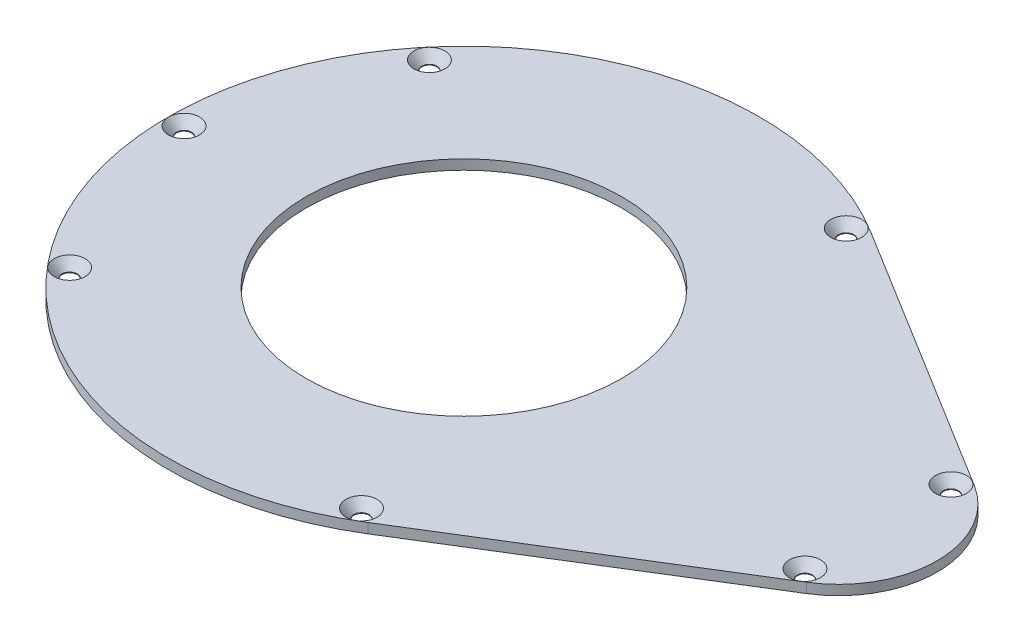
from build123d import *
from build123d.topology import SkipClean

# Parameters (mm, degrees)
SKETCH1_R                                         = 47.625
BOSS_EXTRUDE1_DEPTH                               = 24.13
SKETCH2_R                                         = 46.0375
CUT_EXTRUDE1_DEPTH                                = 20.955
SKETCH3_R                                         = 30.48
CUT_EXTRUDE2_DEPTH                                = 71.536467696
BOSS_EXTRUDE2_START                               = -24.13
BOSS_EXTRUDE2_DEPTH                               = 24.13
CUT_EXTRUDE3_DEPTH                                = 20.955
BOSS_EXTRUDE3_START                               = 3.81
BOSS_EXTRUDE3_DEPTH                               = 3.81
SKETCH7_R                                         = 11.176
CUT_EXTRUDE4_DEPTH                                = 3.81
CHAMFER1_SIZE                                     = 0.762
SKETCH8_R                                         = 5.08
CUT_EXTRUDE5_DEPTH                                = 93.163254725
CSK_FOR_M2_5_FLAT_HEAD_MACHINE_SCREW1_D           = 2.9
CSK_FOR_M2_5_FLAT_HEAD_MACHINE_SCREW1_CSINK_D     = 5.5
CSK_FOR_M2_5_FLAT_HEAD_MACHINE_SCREW1_CSINK_ANGLE = 90
CIRPATTERN1_COUNT                                 = 3
BOSS_EXTRUDE4_DEPTH                               = 5.588
SKETCH12_R                                        = 32.0675
SKETCH12_R_2                                      = 30.48
BOSS_EXTRUDE5_DEPTH                               = 5.588
FILLET2_R                                         = 3.175
F_10_32_TAPPED_HOLE1_D                            = 4.0386
CIRPATTERN2_COUNT                                 = 6
BOSS_EXTRUDE6_REACH                               = 96.68
SKETCH19_R                                        = 2.54
FILLET3_R                                         = 3.175
F_4_40_TAPPED_HOLE1_D                             = 2.2606
F_4_40_TAPPED_HOLE1_DEPTH                         = 7.62
F_4_40_TAPPED_HOLE1_TIP                           = 0.679152758
BOSS_EXTRUDE8_START                               = 1.5875
BOSS_EXTRUDE8_DEPTH                               = 1.5875
CUT_EXTRUDE6_START                                = -29.718
CUT_EXTRUDE6_DEPTH                                = 29.718
CSK_FOR_2_FLAT_HEAD_SOCKET_CAP_SCREW1_A_COUNT     = 2
CSK_FOR_2_FLAT_HEAD_SOCKET_CAP_SCREW1_A_PITCH     = 57.960158765
CSK_FOR_2_FLAT_HEAD_SOCKET_CAP_SCRE_2_COUNT       = 2
CSK_FOR_2_FLAT_HEAD_SOCKET_CAP_SCRE_2_PITCH       = 78.089510659
CSK_FOR_2_FLAT_HEAD_SOCKET_CAP_SCRE_3_COUNT       = 2
CSK_FOR_2_FLAT_HEAD_SOCKET_CAP_SCRE_3_PITCH       = 88.800115089
CSK_FOR_2_FLAT_HEAD_SOCKET_CAP_SCRE_4_COUNT       = 2
CSK_FOR_2_FLAT_HEAD_SOCKET_CAP_SCRE_4_PITCH       = 78.089510659
CSK_FOR_2_FLAT_HEAD_SOCKET_CAP_SCRE_5_COUNT       = 2
CSK_FOR_2_FLAT_HEAD_SOCKET_CAP_SCRE_5_PITCH       = 67.315682226
CSK_FOR_2_FLAT_HEAD_SOCKET_CAP_SCRE_6_COUNT       = 2
CSK_FOR_2_FLAT_HEAD_SOCKET_CAP_SCRE_6_PITCH       = 51.908600383
SKETCH26_R                                        = 25.4
CUT_EXTRUDE7_DEPTH                                = 1.5875


with BuildPart() as part:
    # Sketch1 → Boss-Extrude1 (new body)
    with BuildSketch(Plane(origin=(0, 0, 0), x_dir=(1, 0, 0), z_dir=(0, 1, 0))):
        with Locations(Location((0, 0, 0), (0, 0, 90))):
            Circle(SKETCH1_R)
    extrude(amount=BOSS_EXTRUDE1_DEPTH)

    # Sketch2 → Cut-Extrude1 (cut)
    with BuildSketch(Plane.XZ):
        with Locations(Location((0, 0, 0), (0, 0, 270))):
            Circle(SKETCH2_R)
    extrude(amount=-CUT_EXTRUDE1_DEPTH, mode=Mode.SUBTRACT)

    # Sketch3 → Cut-Extrude2 (cut, through all)
    with BuildSketch(Plane.XZ.offset(-20.955)):
        with Locations(Location((0, 0, 0), (0, 0, 270))):
            Circle(SKETCH3_R)
    extrude(amount=-CUT_EXTRUDE2_DEPTH, mode=Mode.SUBTRACT)

    # Sketch4 → Boss-Extrude2 (add)
    with BuildSketch(Plane(origin=(0, 24.13, 0), x_dir=(1, 0, 0), z_dir=(0, 1, 0)).offset(BOSS_EXTRUDE2_START)):
        with BuildLine():
            Line((25.047860479, 40.506114482), (68.717466826, 13.502038161))
            ThreePointArc((68.717466826, 13.502038161), (76.24318, 0), (68.717466826, -13.502038161))
            Line((68.717466826, -13.502038161), (25.047860479, -40.506114482))
            ThreePointArc((25.047860479, -40.506114482), (47.625, 0), (25.047860479, 40.506114482))
        make_face()
    extrude(amount=BOSS_EXTRUDE2_DEPTH)

    # Sketch5 → Cut-Extrude3 (cut)
    with BuildSketch(Plane.XZ):
        with BuildLine():
            Line((24.212931796, -39.155910666), (67.882538144, -12.151834345))
            ThreePointArc((67.882538144, -12.151834345), (74.65568, 0), (67.882538144, 12.151834345))
            Line((67.882538144, 12.151834345), (24.212931796, 39.155910666))
            ThreePointArc((24.212931796, 39.155910666), (46.0375, 0), (24.212931796, -39.155910666))
        make_face()
    extrude(amount=-CUT_EXTRUDE3_DEPTH, mode=Mode.SUBTRACT)

    # Sketch6 → Boss-Extrude3 (add)
    with BuildSketch(Plane.XZ.offset(-20.955).offset(BOSS_EXTRUDE3_START)):
        with BuildLine():
            Line((53.153553418, 21.25983098), (46.04773497, 25.653872505))
            Line((46.04773497, 25.653872505), (46.882663653, 27.004076321))
            Line((46.882663653, 27.004076321), (68.717466826, 13.502038161))
            ThreePointArc((68.717466826, 13.502038161), (76.24318, 0), (68.717466826, -13.502038161))
            Line((68.717466826, -13.502038161), (46.882663653, -27.004076321))
            Line((46.882663653, -27.004076321), (46.04773497, -25.653872505))
            Line((46.04773497, -25.653872505), (53.153553418, -21.25983098))
            ThreePointArc((53.153553418, -21.25983098), (56.162954155, -15.965000538), (53.331952458, -10.572677144))
            ThreePointArc((53.331952458, -10.572677144), (47.66818, 0), (53.331952458, 10.572677144))
            ThreePointArc((53.331952458, 10.572677144), (56.162954155, 15.965000538), (53.153553418, 21.25983098))
        make_face()
    extrude(amount=-BOSS_EXTRUDE3_DEPTH)

    # Sketch7 → Cut-Extrude4 (cut)
    with BuildSketch(Plane(origin=(0, 24.13, 0), x_dir=(1, 0, 0), z_dir=(0, 1, 0))):
        with Locations(Location((60.36818, 0, 0), (0, 0, 270))):
            Circle(SKETCH7_R)
    extrude(amount=-CUT_EXTRUDE4_DEPTH, mode=Mode.SUBTRACT)

    # Chamfer1
    chamfer1_edges = [part.edges().sort_by_distance(p)[0] for p in [
        (60.36818, 24.13, -11.176),
    ]]
    chamfer(chamfer1_edges, length=CHAMFER1_SIZE)

    # Sketch8 → Cut-Extrude5 (cut, through all)
    with BuildSketch(Plane(origin=(0, 20.32, 0), x_dir=(1, 0, 0), z_dir=(0, 1, 0))):
        with Locations(Location((60.36818, 0, 0), (0, 0, 270))):
            Circle(SKETCH8_R)
    extrude(amount=-CUT_EXTRUDE5_DEPTH, mode=Mode.SUBTRACT)

    # CSK for M2.5 Flat Head Machine Screw1 (through all)
    with Locations(Plane.XZ.offset(-17.145)):
        with Locations((67.36818, 0)):
            csk_for_m2_5_flat_head_machine_screw1 = CounterSinkHole(CSK_FOR_M2_5_FLAT_HEAD_MACHINE_SCREW1_D / 2, CSK_FOR_M2_5_FLAT_HEAD_MACHINE_SCREW1_CSINK_D / 2, counter_sink_angle=CSK_FOR_M2_5_FLAT_HEAD_MACHINE_SCREW1_CSINK_ANGLE)

    # CirPattern1: CSK for M2.5 Flat Head Machine Screw1 ×3 about axis
    cirpattern1_axis = Axis((60.36818, 0, 0), (0, 1, 0))
    for i in range(1, CIRPATTERN1_COUNT):
        add(csk_for_m2_5_flat_head_machine_screw1.rotate(cirpattern1_axis, i * 360 / CIRPATTERN1_COUNT), mode=Mode.SUBTRACT)

    # Sketch11 → Boss-Extrude4 (add)
    with BuildSketch(Plane(origin=(0, 24.13, 0), x_dir=(1, 0, 0), z_dir=(0, 1, 0))):
        with BuildLine():
            Line((-30.83887705, 27.39889836), (-23.975769003, 18.820013302))
            ThreePointArc((-23.975769003, 18.820013302), (-19.040705049, 23.800881312), (-13.098014904, 27.522216582))
            Line((-13.098014904, 27.522216582), (-19.96112295, 36.10110164))
            ThreePointArc((-19.96112295, 36.10110164), (-29.75110164, 37.18887705), (-30.83887705, 27.39889836))
        make_face()
        with BuildLine():
            Line((19.729280139, 36.286575888), (12.821655, 27.652044464))
            ThreePointArc((12.821655, 27.652044464), (19.040705049, 23.800881312), (24.163094721, 18.578892687))
            Line((24.163094721, 18.578892687), (31.070719861, 27.213424112))
            ThreePointArc((31.070719861, 27.213424112), (29.936575888, 37.420719861), (19.729280139, 36.286575888))
        make_face()
    boss_extrude4 = extrude(amount=BOSS_EXTRUDE4_DEPTH)

    # Mirror1: Boss-Extrude4 across plane
    with SkipClean():  # the faces are left unmerged after this step: merging them gives an invalid solid
        add(boss_extrude4.mirror(Plane.XY))

    # Sketch12 → Boss-Extrude5 (add)
    with BuildSketch(Plane(origin=(0, 24.13, 0), x_dir=(1, 0, 0), z_dir=(0, 1, 0))):
        Circle(SKETCH12_R)
        with Locations(Location((0, 0, 0), (0, 0, 90))):
            Circle(SKETCH12_R_2, mode=Mode.SUBTRACT)
    extrude(amount=BOSS_EXTRUDE5_DEPTH)

    # Fillet2
    fillet2_edges = [part.edges().sort_by_distance(p)[0] for p in [
        (-24.993040349, 26.924, 20.091602484),
        (-14.115286249, 26.924, 28.793805764),
        (13.841247416, 26.924, 28.926534985),
        (25.182687137, 26.924, 19.853383208),
        (25.182687137, 26.924, -19.853383208),
        (13.841247416, 26.924, -28.926534985),
        (-14.115286249, 26.924, -28.793805764),
        (-24.993040349, 26.924, -20.091602484),
    ]]
    fillet(fillet2_edges, radius=FILLET2_R)

    # #10-32 Tapped Hole1 (through all)
    with Locations(Plane(origin=(0, 29.718, 0), x_dir=(-1, 0, 0), z_dir=(0, 1, 0))):
        with Locations((25.4, -31.75), (-25.4, -31.75), (25.4, 31.75), (-25.4, 31.75)):
            Hole(F_10_32_TAPPED_HOLE1_D / 2)

    # Sketch17 → #4 Clearance Hole1 (revolve, cut)
    with BuildSketch(Plane(origin=(0, 24.13, -35.56), x_dir=(0, 0, 1), z_dir=(1, 0, 0))):
        Polygon((0, 0), (0, 84.038574487), (1.63195, 83.058), (1.63195, 0), align=None)
    f_4_clearance_hole1 = revolve(axis=Axis((0, 30.48, -35.56), (0, -1, 0)), mode=Mode.SUBTRACT)

    # CirPattern2: #4 Clearance Hole1 ×6 about axis
    cirpattern2_axis = Axis((0, 0, 0), (0, 1, 0))
    for i in range(1, CIRPATTERN2_COUNT):
        add(f_4_clearance_hole1.rotate(cirpattern2_axis, i * 360 / CIRPATTERN2_COUNT), mode=Mode.SUBTRACT)

    # Boss-Extrude6: up to this face of the body (flat: up to its plane)
    boss_extrude6_end = Plane(part.part.faces().sort_by_distance((-44.661893979, 20.955, 0))[0])
    # Sketch19 → Boss-Extrude6 (add, up to the picked face)
    with BuildSketch(Plane.XZ, mode=Mode.PRIVATE) as boss_extrude6_sk1:
        with Locations((-45.085, 0)):
            Circle(SKETCH19_R)
    boss_extrude6_tool1 = split(extrude(boss_extrude6_sk1.sketch, amount=-BOSS_EXTRUDE6_REACH, mode=Mode.PRIVATE), bisect_by=boss_extrude6_end, keep=Keep.BOTH, mode=Mode.PRIVATE)
    # Sketch19 → Boss-Extrude6 (add, up to the picked face)
    with BuildSketch(Plane.XZ, mode=Mode.PRIVATE) as boss_extrude6_sk2:
        with Locations((-34.537113718, 28.980079383)):
            Circle(SKETCH19_R)
    boss_extrude6_tool2 = split(extrude(boss_extrude6_sk2.sketch, amount=-BOSS_EXTRUDE6_REACH, mode=Mode.PRIVATE), bisect_by=boss_extrude6_end, keep=Keep.BOTH, mode=Mode.PRIVATE)
    # Sketch19 → Boss-Extrude6 (add, up to the picked face)
    with BuildSketch(Plane.XZ, mode=Mode.PRIVATE) as boss_extrude6_sk3:
        with Locations((66.702734661, 11.761491808)):
            Circle(SKETCH19_R)
    boss_extrude6_tool3 = split(extrude(boss_extrude6_sk3.sketch, amount=-BOSS_EXTRUDE6_REACH, mode=Mode.PRIVATE), bisect_by=boss_extrude6_end, keep=Keep.BOTH, mode=Mode.PRIVATE)
    # Sketch19 → Boss-Extrude6 (add, up to the picked face)
    with BuildSketch(Plane.XZ, mode=Mode.PRIVATE) as boss_extrude6_sk4:
        with Locations((22.5425, 39.04475533)):
            Circle(SKETCH19_R)
    boss_extrude6_tool4 = split(extrude(boss_extrude6_sk4.sketch, amount=-BOSS_EXTRUDE6_REACH, mode=Mode.PRIVATE), bisect_by=boss_extrude6_end, keep=Keep.BOTH, mode=Mode.PRIVATE)
    # Sketch19 → Boss-Extrude6 (add, up to the picked face)
    with BuildSketch(Plane.XZ, mode=Mode.PRIVATE) as boss_extrude6_sk5:
        with Locations((66.702734661, -11.761491808)):
            Circle(SKETCH19_R)
    boss_extrude6_tool5 = split(extrude(boss_extrude6_sk5.sketch, amount=-BOSS_EXTRUDE6_REACH, mode=Mode.PRIVATE), bisect_by=boss_extrude6_end, keep=Keep.BOTH, mode=Mode.PRIVATE)
    # Sketch19 → Boss-Extrude6 (add, up to the picked face)
    with BuildSketch(Plane.XZ, mode=Mode.PRIVATE) as boss_extrude6_sk6:
        with Locations((22.5425, -39.04475533)):
            Circle(SKETCH19_R)
    boss_extrude6_tool6 = split(extrude(boss_extrude6_sk6.sketch, amount=-BOSS_EXTRUDE6_REACH, mode=Mode.PRIVATE), bisect_by=boss_extrude6_end, keep=Keep.BOTH, mode=Mode.PRIVATE)
    # Sketch19 → Boss-Extrude6 (add, up to the picked face)
    with BuildSketch(Plane.XZ, mode=Mode.PRIVATE) as boss_extrude6_sk7:
        with Locations((-34.537113718, -28.980079383)):
            Circle(SKETCH19_R)
    boss_extrude6_tool7 = split(extrude(boss_extrude6_sk7.sketch, amount=-BOSS_EXTRUDE6_REACH, mode=Mode.PRIVATE), bisect_by=boss_extrude6_end, keep=Keep.BOTH, mode=Mode.PRIVATE)
    add(boss_extrude6_tool1.solids().sort_by(Axis((-45.085, 0, 0), (0, 1, 0)))[0])
    add(boss_extrude6_tool2.solids().sort_by(Axis((-34.537114, 0, 28.980079), (0, 1, 0)))[0])
    add(boss_extrude6_tool3.solids().sort_by(Axis((66.702735, 0, 11.761492), (0, 1, 0)))[0])
    add(boss_extrude6_tool4.solids().sort_by(Axis((22.5425, 0, 39.044755), (0, 1, 0)))[0])
    add(boss_extrude6_tool5.solids().sort_by(Axis((66.702735, 0, -11.761492), (0, 1, 0)))[0])
    add(boss_extrude6_tool6.solids().sort_by(Axis((22.5425, 0, -39.044755), (0, 1, 0)))[0])
    add(boss_extrude6_tool7.solids().sort_by(Axis((-34.537114, 0, -28.980079), (0, 1, 0)))[0])

    # Fillet3
    fillet3_edges = [part.edges().sort_by_distance(p)[0] for p in [
        (-45.976012324, 10.4775, 2.378591398),
        (-45.976012324, 10.4775, -2.378591398),
        (-33.690739678, 10.4775, 31.374917788),
        (-36.748597837, 10.4775, 27.730704342),
        (69.188582602, 8.5725, 11.239802231),
        (65.201015971, 8.5725, 13.810013464),
        (20.928085586, 10.4775, 41.005690336),
        (25.049788012, 10.4775, 38.638421936),
        (65.201015971, 8.5725, -13.810013464),
        (69.188582602, 8.5725, -11.239802231),
        (25.049788012, 10.4775, -38.638421936),
        (20.928085586, 10.4775, -41.005690336),
        (-33.690739678, 10.4775, -31.374917788),
        (-36.748597837, 10.4775, -27.730704342),
    ]]
    fillet(fillet3_edges, radius=FILLET3_R)

    # #4-40 Tapped Hole1
    with Locations(Plane.XZ):
        with Locations((-34.537113718, 28.980079383), (22.5425, 39.04475533), (66.702734661, 11.761491808), (66.702734661, -11.761491808), (22.5425, -39.04475533), (-34.537113718, -28.980079383), (-45.085, 0)):
            Hole(F_4_40_TAPPED_HOLE1_D / 2, depth=F_4_40_TAPPED_HOLE1_DEPTH)
            with Locations((0, 0, -(F_4_40_TAPPED_HOLE1_DEPTH + F_4_40_TAPPED_HOLE1_TIP / 2))):  # 118° drill point
                Cone(0, F_4_40_TAPPED_HOLE1_D / 2, F_4_40_TAPPED_HOLE1_TIP, mode=Mode.SUBTRACT)

    # Sketch22 → Boss-Extrude8 (add)
    with BuildSketch(Plane.XZ.offset(BOSS_EXTRUDE8_START)):
        with BuildLine():
            Line((68.717466826, 13.502038161), (25.047860479, 40.506114482))
            ThreePointArc((25.047860479, 40.506114482), (-47.625, 0), (25.047860479, -40.506114482))
            Line((25.047860479, -40.506114482), (68.717466826, -13.502038161))
            ThreePointArc((68.717466826, -13.502038161), (76.24318, 0), (68.717466826, 13.502038161))
        make_face()
    extrude(amount=-BOSS_EXTRUDE8_DEPTH)

    # Sketch23 → Cut-Extrude6 (cut)
    with BuildSketch(Plane(origin=(0, 29.718, 0), x_dir=(1, 0, 0), z_dir=(0, 1, 0)).offset(CUT_EXTRUDE6_START)):
        with BuildLine():
            Line((29.219405455, -37.926546486), (68.717466826, -13.502038161))
            ThreePointArc((68.717466826, -13.502038161), (76.24318, 0), (68.717466826, 13.502038161))
            Line((68.717466826, 13.502038161), (29.219405455, 37.926546486))
            Line((29.219405455, 37.926546486), (25.047860479, 40.506114482))
            ThreePointArc((25.047860479, 40.506114482), (-2.877696197, 47.537979444), (-29.75110164, 37.18887705))
            ThreePointArc((-29.75110164, 37.18887705), (-47.625, 0), (-29.75110164, -37.18887705))
            ThreePointArc((-29.75110164, -37.18887705), (-2.877696197, -47.537979444), (25.047860479, -40.506114482))
            Line((25.047860479, -40.506114482), (29.219405455, -37.926546486))
        make_face()
    extrude(amount=CUT_EXTRUDE6_DEPTH, mode=Mode.SUBTRACT)

    # Sketch24 → CSK for #2 Flat Head Socket Cap Screw1 (revolve, cut)
    with BuildSketch(Plane(origin=(22.5425, 0, -39.04475533), x_dir=(0, 0, 1), z_dir=(1, 0, 0))):
        Polygon((0, 0), (0, 1.5875), (1.2192, 1.5875), (1.2192, 1.475577556), (2.5019, 0), align=None)
    csk_for_2_flat_head_socket_cap_screw1 = revolve(axis=Axis((22.5425, 6.35, -39.04475533), (0, -1, 0)), mode=Mode.SUBTRACT)

    # CSK for #2 Flat Head Socket Cap Screw1 a: CSK for #2 Flat Head Socket Cap Screw1 ×2
    with Locations(*[Vector(-0.984807753012208, 0, 0.17364817766693103) * (i * CSK_FOR_2_FLAT_HEAD_SOCKET_CAP_SCREW1_A_PITCH) for i in range(1, CSK_FOR_2_FLAT_HEAD_SOCKET_CAP_SCREW1_A_COUNT)]):
        add(csk_for_2_flat_head_socket_cap_screw1, mode=Mode.SUBTRACT)

    # CSK for _2 Flat Head Socket Cap Scre 2: CSK for #2 Flat Head Socket Cap Screw1 ×2
    with Locations(*[Vector(-0.8660254037844379, 0, 0.5000000000000012) * (i * CSK_FOR_2_FLAT_HEAD_SOCKET_CAP_SCRE_2_PITCH) for i in range(1, CSK_FOR_2_FLAT_HEAD_SOCKET_CAP_SCRE_2_COUNT)]):
        add(csk_for_2_flat_head_socket_cap_screw1, mode=Mode.SUBTRACT)

    # CSK for _2 Flat Head Socket Cap Scre 3: CSK for #2 Flat Head Socket Cap Screw1 ×2
    with Locations(*[Vector(-0.6427876096865378, 0, 0.7660444431189793) * (i * CSK_FOR_2_FLAT_HEAD_SOCKET_CAP_SCRE_3_PITCH) for i in range(1, CSK_FOR_2_FLAT_HEAD_SOCKET_CAP_SCRE_3_COUNT)]):
        add(csk_for_2_flat_head_socket_cap_screw1, mode=Mode.SUBTRACT)

    # CSK for _2 Flat Head Socket Cap Scre 4: CSK for #2 Flat Head Socket Cap Screw1 ×2
    with Locations(*[(0, 0, i * CSK_FOR_2_FLAT_HEAD_SOCKET_CAP_SCRE_4_PITCH) for i in range(1, CSK_FOR_2_FLAT_HEAD_SOCKET_CAP_SCRE_4_COUNT)]):
        add(csk_for_2_flat_head_socket_cap_screw1, mode=Mode.SUBTRACT)

    # CSK for _2 Flat Head Socket Cap Scre 5: CSK for #2 Flat Head Socket Cap Screw1 ×2
    with Locations(*[Vector(0.6560170409199186, 0, 0.7547460778451742) * (i * CSK_FOR_2_FLAT_HEAD_SOCKET_CAP_SCRE_5_PITCH) for i in range(1, CSK_FOR_2_FLAT_HEAD_SOCKET_CAP_SCRE_5_COUNT)]):
        add(csk_for_2_flat_head_socket_cap_screw1, mode=Mode.SUBTRACT)

    # CSK for _2 Flat Head Socket Cap Scre 6: CSK for #2 Flat Head Socket Cap Screw1 ×2
    with Locations(*[Vector(0.8507305983078669, 0, 0.5256019873466412) * (i * CSK_FOR_2_FLAT_HEAD_SOCKET_CAP_SCRE_6_PITCH) for i in range(1, CSK_FOR_2_FLAT_HEAD_SOCKET_CAP_SCRE_6_COUNT)]):
        add(csk_for_2_flat_head_socket_cap_screw1, mode=Mode.SUBTRACT)

    # Sketch26 → Cut-Extrude7 (cut)
    with BuildSketch(Plane(origin=(0, 0, 0), x_dir=(1, 0, 0), z_dir=(0, 1, 0))):
        with Locations(Location((0, 0, 0), (0, 0, 270))):
            Circle(SKETCH26_R)
    extrude(amount=-CUT_EXTRUDE7_DEPTH, mode=Mode.SUBTRACT)


solid = part.part
